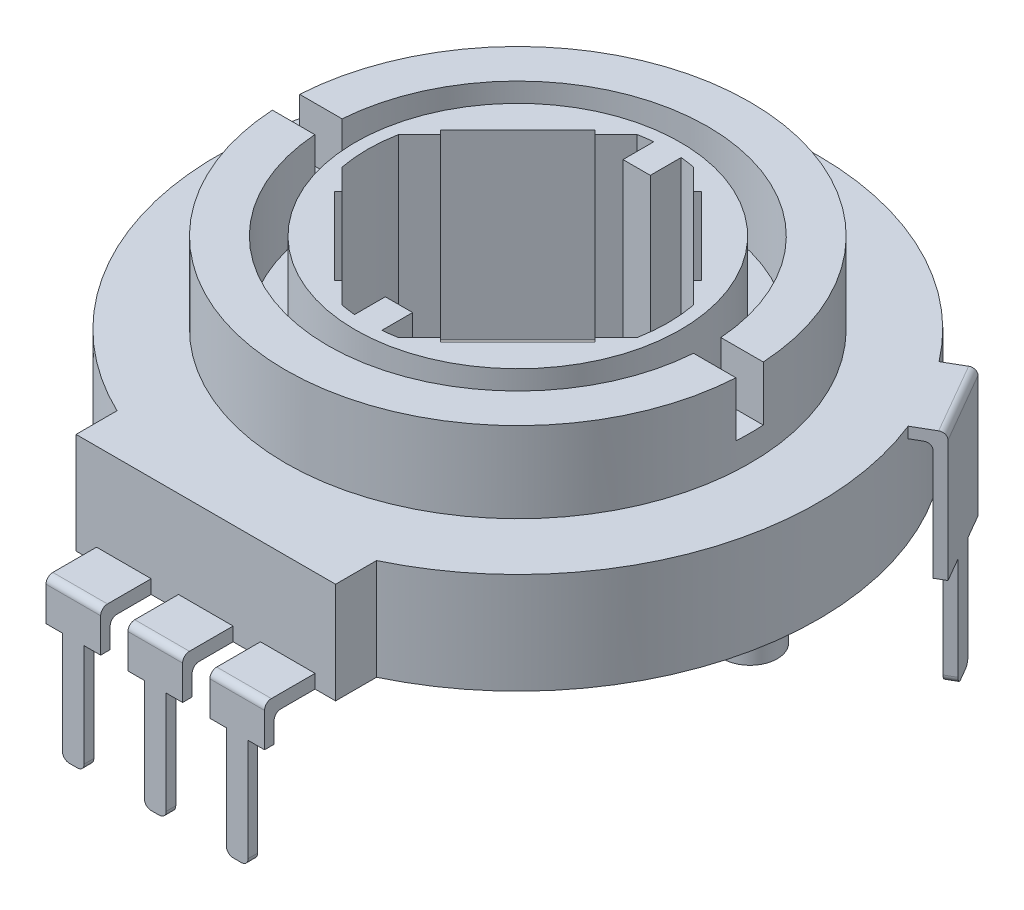
from build123d import *
from build123d.topology import SkipClean

# Parameters (mm, degrees)
BOSS_EXTRUDE1_DEPTH      = 4
SKETCH1_W                = 0.8
SKETCH1_H                = 0.35
BOSS_EXTRUDE1_2_DEPTH    = 4
BOSS_EXTRUDE1_3_DEPTH    = 4
BOSS_EXTRUDE1_4_DEPTH    = 4
BOSS_EXTRUDE1_5_DEPTH    = 4
SKETCH2_W                = 0.6
SKETCH2_H                = 0.35
SKETCH2_W_2              = 0.8
SKETCH2_W_3              = 2
BOSS_EXTRUDE2_DEPTH      = 1.5
SKETCH3_W                = 2
SKETCH3_H                = 0.5
BOSS_EXTRUDE3_DEPTH      = 1.5
BOSS_EXTRUDE4_DEPTH      = 3.7
BOSS_EXTRUDE6_DEPTH      = 3.2
BOSS_EXTRUDE7_REACH      = 33.958
BOSS_EXTRUDE7_END_RADIUS = 11
SKETCH7_W                = 3
SKETCH7_H                = 0.4
BOSS_EXTRUDE8_REACH      = 33.958
SKETCH8_W                = 3
SKETCH8_H                = 0.4
SKETCH9_R                = 1
BOSS_EXTRUDE9_DEPTH      = 2
SKETCH5_R                = 8.5
BOSS_EXTRUDE5_DEPTH      = 4.952033783
FILLET1_R                = 0.25
FILLET2_R                = 0.25
SKETCH10_R               = 5.5
CUT_EXTRUDE1_DEPTH       = 2
CUT_EXTRUDE2_DEPTH       = 29.992852085
BOSS_EXTRUDE10_START     = -8.652034
BOSS_EXTRUDE10_DEPTH     = 8.652034
CIRPATTERN2_COUNT        = 4
SKETCH13_R               = 6.95
SKETCH13_R_2             = 5.95
CUT_EXTRUDE3_DEPTH       = 4.952033783
CHAMFER1_SIZE            = 1
CUT_EXTRUDE4_REACH       = 35.954
CUT_EXTRUDE4_END_RADIUS  = 6.95
CUT_EXTRUDE5_START       = -17
CUT_EXTRUDE5_DEPTH       = 2.01521
CUT_EXTRUDE6_START       = -2.000004
SKETCH16_R               = 8.5
CUT_EXTRUDE6_DEPTH       = 2.000004


with BuildPart() as part:
    # Sketch1 → Boss-Extrude1 (new body)
    with BuildSketch(Plane(origin=(0, 0, 0), x_dir=(1, 0, 0), z_dir=(0, 1, 0))):
        Polygon((9.796794919, 19.233012702), (10.143205081, 19.433012702), (10.643205081, 18.566987298), (10.296794919, 18.366987298), align=None)
    extrude(amount=BOSS_EXTRUDE1_DEPTH)



with BuildPart() as body_2:
    # Sketch1 → Boss-Extrude1 2 (new body)
    with BuildSketch(Plane(origin=(0, 0, 0), x_dir=(1, 0, 0), z_dir=(0, 1, 0))):
        with Locations((-3, 0)):
            Rectangle(SKETCH1_W, SKETCH1_H)
    extrude(amount=BOSS_EXTRUDE1_2_DEPTH)


with BuildPart() as body_3:
    # Sketch1 → Boss-Extrude1 3 (new body)
    with BuildSketch(Plane(origin=(0, 0, 0), x_dir=(1, 0, 0), z_dir=(0, 1, 0))):
        Rectangle(SKETCH1_W, SKETCH1_H)
    extrude(amount=BOSS_EXTRUDE1_3_DEPTH)


with BuildPart() as body_4:
    # Sketch1 → Boss-Extrude1 4 (new body)
    with BuildSketch(Plane(origin=(0, 0, 0), x_dir=(1, 0, 0), z_dir=(0, 1, 0))):
        with Locations((3, 0)):
            Rectangle(SKETCH1_W, SKETCH1_H)
    extrude(amount=BOSS_EXTRUDE1_4_DEPTH)


with BuildPart() as body_5:
    # Sketch1 → Boss-Extrude1 5 (new body)
    with BuildSketch(Plane(origin=(0, 0, 0), x_dir=(1, 0, 0), z_dir=(0, 1, 0))):
        Polygon((-10.296794919, 18.366987298), (-10.643205081, 18.566987298), (-10.143205081, 19.433012702), (-9.796794919, 19.233012702), align=None)
    extrude(amount=BOSS_EXTRUDE1_5_DEPTH)


with BuildPart() as part_1:
    add(part.part)

    add(body_2.part)  # Boss-Extrude2 merges body 2

    add(body_3.part)  # Boss-Extrude2 merges body 3

    add(body_4.part)  # Boss-Extrude2 merges body 4

    add(body_5.part)  # Boss-Extrude2 merges body 5
    # Sketch2 → Boss-Extrude2 (add)
    with BuildSketch(Plane(origin=(0, 4, 0), x_dir=(1, 0, 0), z_dir=(0, 1, 0))):
        Polygon((-11.143205081, 17.700961894), (-9.643205081, 20.299038106), (-9.296794919, 20.099038106), (-10.796794919, 17.500961894), align=None)
        Polygon((9.643205081, 20.299038106), (11.143205081, 17.700961894), (10.796794919, 17.500961894), (9.296794919, 20.099038106), align=None)
        with Locations((0.7, 0)):
            Rectangle(SKETCH2_W, SKETCH2_H)
        Rectangle(SKETCH2_W_2, SKETCH2_H)
        with Locations((-0.7, 0)):
            Rectangle(SKETCH2_W, SKETCH2_H)
        with Locations((-3, 0)):
            Rectangle(SKETCH2_W_3, SKETCH2_H)
        with Locations((3, 0)):
            Rectangle(SKETCH2_W_3, SKETCH2_H)
    extrude(amount=BOSS_EXTRUDE2_DEPTH)

    # Sketch3 → Boss-Extrude3 (add)
    with BuildSketch(Plane(origin=(0, 0, -0.175), x_dir=(-1, 0, 0), z_dir=(0, 0, -1))):
        with Locations((-3, 5.25)):
            Rectangle(SKETCH3_W, SKETCH3_H)
        with Locations((0, 5.25)):
            Rectangle(SKETCH3_W, SKETCH3_H)
        with Locations((3, 5.25)):
            Rectangle(SKETCH3_W, SKETCH3_H)
    extrude(amount=BOSS_EXTRUDE3_DEPTH)

    # Sketch4 → Boss-Extrude4 (add)
    with BuildSketch(Plane.XZ.offset(-5)):
        with BuildLine():
            Line((-4.75, -1.675), (4.75, -1.675))
            Line((4.75, -1.675), (4.75, -3.175))
            ThreePointArc((4.75, -3.175), (0, -24.096567416), (-4.75, -3.175))
            Line((-4.75, -3.175), (-4.75, -1.675))
        make_face()
    extrude(amount=-BOSS_EXTRUDE4_DEPTH)

    # Sketch6 → Boss-Extrude6 (add)
    with BuildSketch(Plane(origin=(0, 5.5, 0), x_dir=(1, 0, 0), z_dir=(0, 1, 0))):
        Polygon((-9.643205081, 20.299038106), (-11.143205081, 17.700961894), (-10.796794919, 17.500961894), (-9.296794919, 20.099038106), align=None)
        Polygon((11.143205081, 17.700961894), (9.643205081, 20.299038106), (9.296794919, 20.099038106), (10.796794919, 17.500961894), align=None)
    extrude(amount=BOSS_EXTRUDE6_DEPTH)

    # Boss-Extrude7: up to this cylinder (the profile starts outside it)
    boss_extrude7_end = Plane(origin=(0, 8.5, -13.096567416), z_dir=(0, -1, 0)) * Cylinder(BOSS_EXTRUDE7_END_RADIUS, 90.916, mode=Mode.PRIVATE)
    # Sketch7 → Boss-Extrude7 (add, up to the surface)
    with BuildSketch(Plane(origin=(15.675734985, 0, -9.050389813), x_dir=(0.4999999999999947, 0, 0.8660254037844417), z_dir=(-0.8660254037844418, 0, 0.49999999999999484)), mode=Mode.PRIVATE) as boss_extrude7_sk1:
        with Locations((-11.257880132, 8.5)):
            Rectangle(SKETCH7_W, SKETCH7_H)
    boss_extrude7_tool1 = extrude(boss_extrude7_sk1.sketch, amount=BOSS_EXTRUDE7_REACH, mode=Mode.PRIVATE) - boss_extrude7_end
    add(boss_extrude7_tool1.solids().sort_by_distance((10.046795, 8.5, -18.8))[0])

    # Sketch8 → Boss-Extrude8 (add, up to next)
    with BuildSketch(Plane(origin=(-15.675734985, 0, -9.050389813), x_dir=(0.4999999999999956, 0, -0.8660254037844413), z_dir=(0.8660254037844413, 0, 0.4999999999999956)), mode=Mode.PRIVATE) as boss_extrude8_sk1:
        with Locations((11.257880132, 8.5)):
            Rectangle(SKETCH8_W, SKETCH8_H)
    boss_extrude8_tool1 = extrude(boss_extrude8_sk1.sketch, amount=BOSS_EXTRUDE8_REACH, mode=Mode.PRIVATE) - part_1.part
    add(boss_extrude8_tool1.solids().sort_by_distance((-10.046795, 8.5, -18.8))[0])

    # Sketch9 → Boss-Extrude9 (add)
    with BuildSketch(Plane.XZ.offset(-5)):
        with Locations(Location((-8.5, -13.096567416, 0), (0, 0, 90))):
            Circle(SKETCH9_R)
        with Locations(Location((8.5, -13.096567416, 0), (0, 0, 90))):
            Circle(SKETCH9_R)
    extrude(amount=BOSS_EXTRUDE9_DEPTH)

    # Sketch5 → Boss-Extrude5 (add)
    with BuildSketch(Plane(origin=(0, 8.7, 0), x_dir=(1, 0, 0), z_dir=(0, 1, 0))):
        with Locations(Location((0, 13.096567416, 0), (0, 0, 270))):
            Circle(SKETCH5_R)
    extrude(amount=BOSS_EXTRUDE5_DEPTH)

    # Fillet1
    fillet1_edges = [part_1.edges().sort_by_distance(p)[0] for p in [
        (-10.393205081, 8.7, -19),
        (-10.046794919, 8.3, -18.8),
        (-3, 5.5, 0.175),
        (-3, 5, -0.175),
        (3, 5, -0.175),
        (0, 5, -0.175),
        (0, 5.5, 0.175),
        (3, 5.5, 0.175),
        (10.046794919, 8.3, -18.8),
        (10.393205081, 8.7, -19),
    ]]
    fillet(fillet1_edges, radius=FILLET1_R)

    # Fillet2
    fillet2_edges = [part_1.edges().sort_by_distance(p)[0] for p in [
        (-3.4, 0, 0),
        (-2.6, 0, 0),
        (-10.47, 0, -18.466987298),
        (-0.4, 0, 0),
        (0.4, 0, 0),
        (2.6, 0, 0),
        (3.4, 0, 0),
        (-9.97, 0, -19.333012702),
        (10.47, 0, -18.466987298),
        (9.97, 0, -19.333012702),
    ]]
    fillet(fillet2_edges, radius=FILLET2_R)

    # Sketch10 → Cut-Extrude1 (cut)
    with BuildSketch(Plane(origin=(0, 13.652033783, 0), x_dir=(1, 0, 0), z_dir=(0, 1, 0))):
        with Locations(Location((0, 13.096567416, 0), (0, 0, 270))):
            Circle(SKETCH10_R)
    extrude(amount=-CUT_EXTRUDE1_DEPTH, mode=Mode.SUBTRACT)

    # Sketch11 → Cut-Extrude2 (cut, through all)
    with BuildSketch(Plane(origin=(0, 11.652033783, 0), x_dir=(1, 0, 0), z_dir=(0, 1, 0))):
        with BuildLine():
            Line((-5.319305603, 14.494776234), (-1.398208818, 18.41587302))
            ThreePointArc((-1.398208818, 18.41587302), (-0.952383252, 18.513482234), (-0.5, 18.573792992))
            Line((-0.5, 18.573792992), (-0.5, 17.446567416))
            Line((-0.5, 17.446567416), (0.5, 17.446567416))
            Line((0.5, 17.446567416), (0.5, 18.573792992))
            ThreePointArc((0.5, 18.573792992), (0.952383252, 18.513482234), (1.398208818, 18.41587302))
            Line((1.398208818, 18.41587302), (5.319305603, 14.494776234))
            ThreePointArc((5.319305603, 14.494776234), (5.5, 13.096567416), (5.319305603, 11.698358599))
            Line((5.319305603, 11.698358599), (1.398208818, 7.777261813))
            ThreePointArc((1.398208818, 7.777261813), (0.952383252, 7.679652599), (0.5, 7.619341841))
            Line((0.5, 7.619341841), (0.5, 8.746567416))
            Line((0.5, 8.746567416), (-0.5, 8.746567416))
            Line((-0.5, 8.746567416), (-0.5, 7.619341841))
            ThreePointArc((-0.5, 7.619341841), (-0.952383252, 7.679652599), (-1.398208818, 7.777261813))
            Line((-1.398208818, 7.777261813), (-5.319305603, 11.698358599))
            ThreePointArc((-5.319305603, 11.698358599), (-5.5, 13.096567416), (-5.319305603, 14.494776234))
        make_face()
    extrude(amount=-CUT_EXTRUDE2_DEPTH, mode=Mode.SUBTRACT)

    # Sketch12 → Boss-Extrude10 (add)
    with BuildSketch(Plane(origin=(0, 13.652033783, 0), x_dir=(1, 0, 0), z_dir=(0, 1, 0)).offset(BOSS_EXTRUDE10_START)):
        with BuildLine():
            Line((-2.208630624, 18.133625165), (-1.803122292, 17.728116833))
            Line((-1.803122292, 17.728116833), (-1.032444553, 18.498794573))
            ThreePointArc((-1.032444553, 18.498794573), (-1.630790989, 18.349235381), (-2.208630624, 18.133625165))
        make_face()
        with BuildLine():
            Line((-5.037057749, 15.305198041), (-4.631549417, 14.899689709))
            Line((-4.631549417, 14.899689709), (-5.402227156, 14.129011969))
            ThreePointArc((-5.402227156, 14.129011969), (-5.252667965, 14.727358405), (-5.037057749, 15.305198041))
        make_face()
    boss_extrude10 = extrude(amount=BOSS_EXTRUDE10_DEPTH)

    # CirPattern2: Boss-Extrude10 ×4 about axis
    cirpattern2_axis = Axis((0, 0, -13.096567416), (0, 1, 0))
    for i in range(1, CIRPATTERN2_COUNT):
        add(boss_extrude10.rotate(cirpattern2_axis, i * 360 / CIRPATTERN2_COUNT))

    # Sketch13 → Cut-Extrude3 (cut)
    with SkipClean():  # the faces are left unmerged after this step: merging them gives an invalid solid
        with BuildSketch(Plane(origin=(0, 13.652033783, 0), x_dir=(1, 0, 0), z_dir=(0, 1, 0))):
            with Locations(Location((0, 13.096567416, 0), (0, 0, 270))):
                Circle(SKETCH13_R)
            with Locations(Location((0, 13.096567416, 0), (0, 0, 270))):
                Circle(SKETCH13_R_2, mode=Mode.SUBTRACT)
        extrude(amount=-CUT_EXTRUDE3_DEPTH, mode=Mode.SUBTRACT)

    # Chamfer1
    chamfer1_edges = [part_1.edges().sort_by_distance(p)[0] for p in [
        (0, 13.652033783, -21.596567416),
    ]]
    chamfer(chamfer1_edges, length=CHAMFER1_SIZE)

    # Cut-Extrude4: up to this cylinder (the profile starts outside it)
    with SkipClean():  # the faces are left unmerged after this step: merging them gives an invalid solid
        cut_extrude4_end = Plane(origin=(0, 12.3187, -13.096567416), z_dir=(0, 1, 0)) * Cylinder(CUT_EXTRUDE4_END_RADIUS, 86.808, mode=Mode.PRIVATE)
        # Sketch14 → Cut-Extrude4 (cut, up to the surface)
        with BuildSketch(Plane(origin=(8.5, 0, 0), x_dir=(0, 0, -1), z_dir=(1, 0, 0)), mode=Mode.PRIVATE) as cut_extrude4_sk1:
            Polygon((10.596567416, 13.652033783), (12.596567416, 11.652033783), (12.596567416, 9.652033783), (13.596567416, 9.652033783), (13.596567416, 11.652033783), (15.596567416, 13.652033783), align=None)
        cut_extrude4_tool1 = extrude(cut_extrude4_sk1.sketch, amount=-CUT_EXTRUDE4_REACH, mode=Mode.PRIVATE) - cut_extrude4_end
        add(cut_extrude4_tool1.solids().sort_by_distance((8.5, 12.3187, -13.096567))[0], mode=Mode.SUBTRACT)

    # Sketch14<2> → Cut-Extrude5 (cut)
    with SkipClean():  # the faces are left unmerged after this step: merging them gives an invalid solid
        with BuildSketch(Plane(origin=(8.5, 0, 0), x_dir=(0, 0, -1), z_dir=(1, 0, 0)).offset(CUT_EXTRUDE5_START)):
            Polygon((10.596567416, 13.652033783), (12.596567416, 11.652033783), (12.596567416, 9.652033783), (13.596567416, 9.652033783), (13.596567416, 11.652033783), (15.596567416, 13.652033783), align=None)
        extrude(amount=CUT_EXTRUDE5_DEPTH, mode=Mode.SUBTRACT)

    # Sketch16 → Cut-Extrude6 (cut)
    with BuildSketch(Plane(origin=(0, 13.652033783, 0), x_dir=(1, 0, 0), z_dir=(0, 1, 0)).offset(CUT_EXTRUDE6_START)):
        with Locations(Location((0, 13.096567416, 0), (0, 0, 3.372286684))):
            Circle(SKETCH16_R)
    extrude(amount=CUT_EXTRUDE6_DEPTH, mode=Mode.SUBTRACT)


solid = part_1.part
